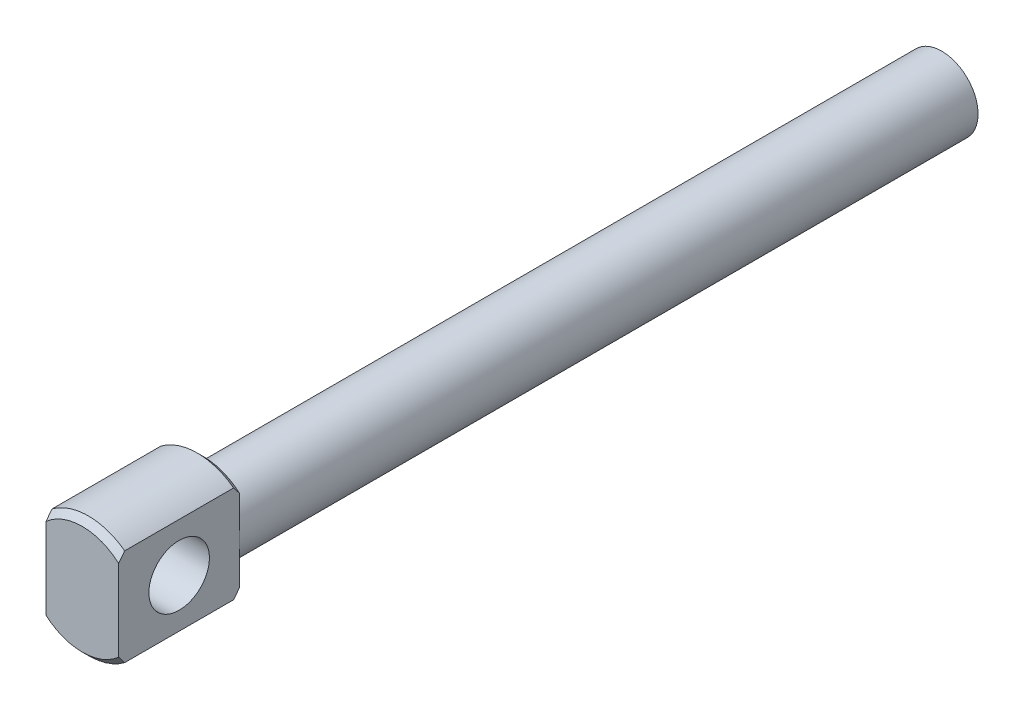
from build123d import *

# Parameters (mm, degrees)
BOSS_EXTRUDE1_DEPTH = 10
SKETCH2_R           = 3
BOSS_EXTRUDE2_DEPTH = 61
CHAMFER1_SIZE       = 0.5
SKETCH3_R           = 2.5
CUT_EXTRUDE1_DEPTH  = 61


with BuildPart() as part:
    # Sketch1 → Boss-Extrude1 (new body)
    with BuildSketch(Plane.XY):
        with BuildLine():
            Line((3, 4), (3, -4))
            ThreePointArc((3, -4), (0, -5), (-3, -4))
            Line((-3, -4), (-3, 4))
            ThreePointArc((-3, 4), (0, 5), (3, 4))
        make_face()
    extrude(amount=-BOSS_EXTRUDE1_DEPTH)

    # Sketch2 → Boss-Extrude2 (add)
    with BuildSketch(Plane(origin=(0, 0, -10), x_dir=(-1, 0, 0), z_dir=(0, 0, -1))):
        Circle(SKETCH2_R)
    extrude(amount=BOSS_EXTRUDE2_DEPTH)

    # Chamfer1
    chamfer1_edges = [part.edges().sort_by_distance(p)[0] for p in [
        (0, -5, -10),
        (0, 5, -10),
        (0, -5, 0),
        (0, 5, 0),
    ]]
    chamfer(chamfer1_edges, length=CHAMFER1_SIZE)

    # Sketch3 → Cut-Extrude1 (cut)
    with BuildSketch(Plane.ZY.offset(3)):
        with Locations((-5, 0)):
            Circle(SKETCH3_R)
    extrude(amount=-CUT_EXTRUDE1_DEPTH, mode=Mode.SUBTRACT)


solid = part.part
